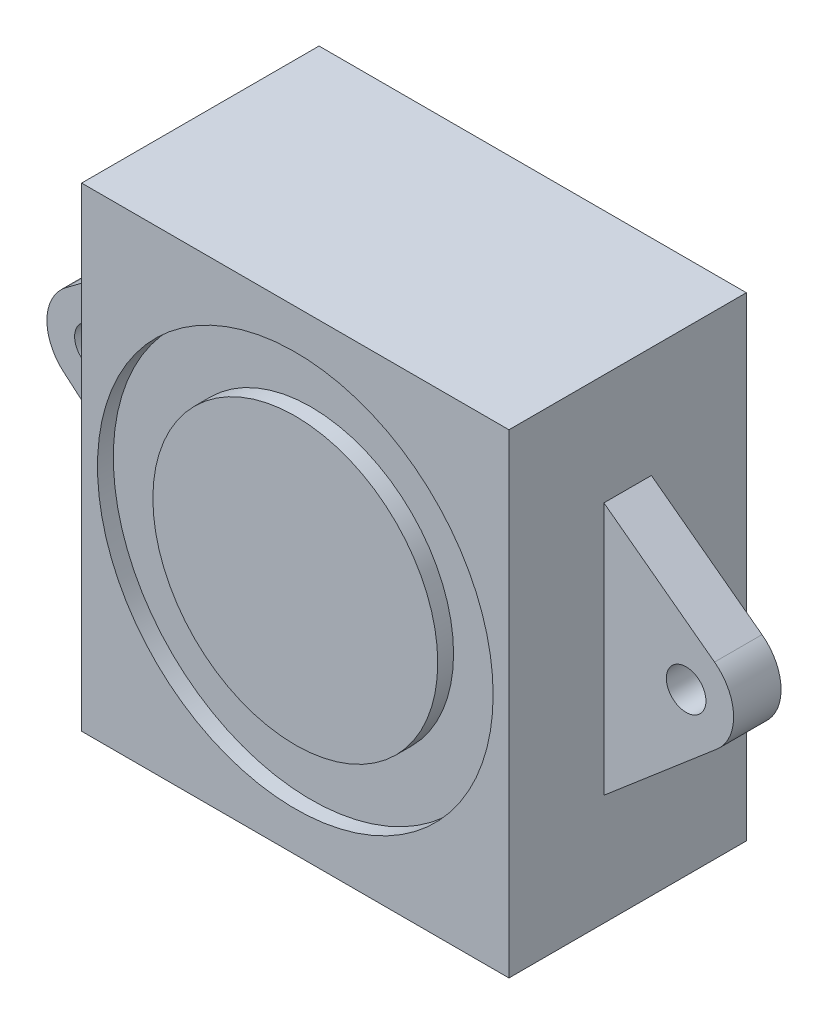
from build123d import *

# Parameters (mm, degrees)
SKETCH1_W           = 27
SKETCH1_H           = 30
BOSS_EXTRUDE1_DEPTH = 15
SKETCH2_R           = 12.5
SKETCH2_R_2         = 9
CUT_EXTRUDE1_DEPTH  = 1
SKETCH3_R           = 1.25
BOSS_EXTRUDE2_DEPTH = 9
SKETCH4_W           = 10.736601318
SKETCH4_H           = 16
CUT_EXTRUDE2_DEPTH  = 6


with BuildPart() as part:
    # Sketch1 → Boss-Extrude1 (new body)
    with BuildSketch(Plane.XY):
        with Locations((13.5, 15)):
            Rectangle(SKETCH1_W, SKETCH1_H)
    extrude(amount=BOSS_EXTRUDE1_DEPTH)

    # Sketch2 → Cut-Extrude1 (cut)
    with BuildSketch(Plane.XY.offset(15)):
        with Locations((13.5, 15)):
            Circle(SKETCH2_R)
        with Locations((13.5, 15)):
            Circle(SKETCH2_R_2, mode=Mode.SUBTRACT)
    extrude(amount=-CUT_EXTRUDE1_DEPTH, mode=Mode.SUBTRACT)

    # Sketch3 → Boss-Extrude2 (add)
    # profile 1 of 2: a face of its own
    with BuildSketch(Plane.XY.offset(15)):
        with BuildLine():
            Line((0, 7), (0, 23))
            Line((0, 23), (-6.989512345, 17.783175422))
            ThreePointArc((-6.989512345, 17.783175422), (-8.193484437, 15.477105093), (-7.142826585, 13.097267443))
            Line((-7.142826585, 13.097267443), (0, 7))
        make_face()
        with Locations((-5.195088865, 15.379003137)):
            Circle(SKETCH3_R, mode=Mode.SUBTRACT)
    # profile 2 of 2: a face of its own
    with BuildSketch(Plane.XY.offset(15)):
        with BuildLine():
            Line((27, 7), (34.142826585, 13.097267443))
            ThreePointArc((34.142826585, 13.097267443), (35.193484437, 15.477105093), (33.989512345, 17.783175422))
            Line((33.989512345, 17.783175422), (27, 23))
            Line((27, 23), (27, 7))
        make_face()
        with Locations((32.195088865, 15.379003137)):
            Circle(SKETCH3_R, mode=Mode.SUBTRACT)
    extrude(amount=-BOSS_EXTRUDE2_DEPTH)

    # Sketch4 → Cut-Extrude2 (cut)
    with BuildSketch(Plane.XY.offset(15)):
        Polygon((0, 23), (-13.068539103, 23), (-13.068539103, 5.328314146), (0, 7), align=None)
        with Locations((32.368300659, 15)):
            Rectangle(SKETCH4_W, SKETCH4_H)
    extrude(amount=-CUT_EXTRUDE2_DEPTH, mode=Mode.SUBTRACT)


solid = part.part
